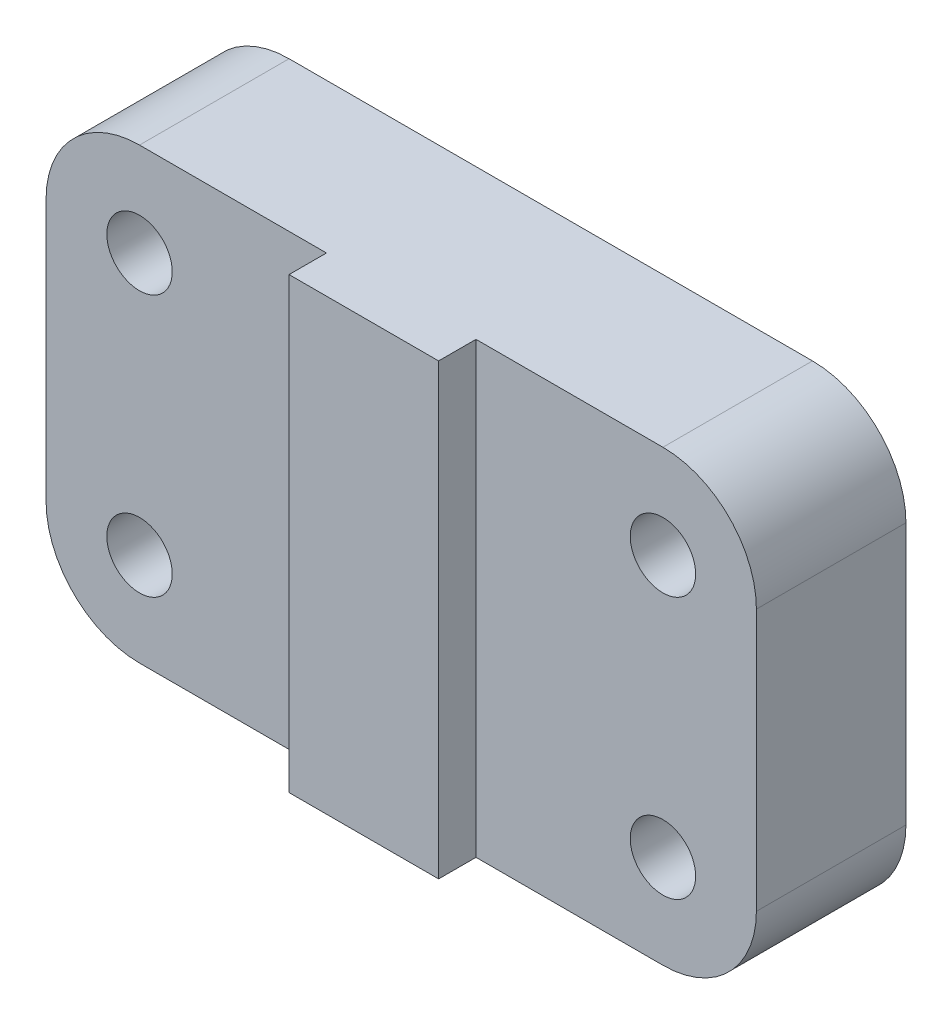
from build123d import *

# Parameters (mm, degrees)
BOSS_EXTRUDE3_DEPTH    = 40
M20_TAPPED_HOLE1_D     = 17.5
M20_TAPPED_HOLE1_DEPTH = 25
M20_TAPPED_HOLE1_TIP   = 5.257530416
SKETCH6_W              = 40
SKETCH6_H              = 120
BOSS_EXTRUDE4_DEPTH    = 10


with BuildPart() as part:
    # Sketch1 → Boss-Extrude3 (new body)
    with BuildSketch(Plane.XY):
        with BuildLine():
            Line((70, 60), (-70, 60))
            ThreePointArc((-70, 60), (-87.67766953, 52.67766953), (-95, 35))
            Line((-95, 35), (-95, -35))
            ThreePointArc((-95, -35), (-87.67766953, -52.67766953), (-70, -60))
            Line((-70, -60), (70, -60))
            ThreePointArc((70, -60), (87.67766953, -52.67766953), (95, -35))
            Line((95, -35), (95, 35))
            ThreePointArc((95, 35), (87.67766953, 52.67766953), (70, 60))
        make_face()
    extrude(amount=BOSS_EXTRUDE3_DEPTH)

    # M20 Tapped Hole1
    with Locations(Plane(origin=(-70, 35, 40), x_dir=(1, 0, 0), z_dir=(0, 0, 1))):
        with Locations((0, 0), (0, -70), (140, -70), (140, 0)):
            Hole(M20_TAPPED_HOLE1_D / 2, depth=M20_TAPPED_HOLE1_DEPTH)
            with Locations((0, 0, -(M20_TAPPED_HOLE1_DEPTH + M20_TAPPED_HOLE1_TIP / 2))):  # 118° drill point
                Cone(0, M20_TAPPED_HOLE1_D / 2, M20_TAPPED_HOLE1_TIP, mode=Mode.SUBTRACT)

    # Sketch6 → Boss-Extrude4 (add)
    with BuildSketch(Plane.XY.offset(40)):
        Rectangle(SKETCH6_W, SKETCH6_H)
    extrude(amount=BOSS_EXTRUDE4_DEPTH)


solid = part.part
